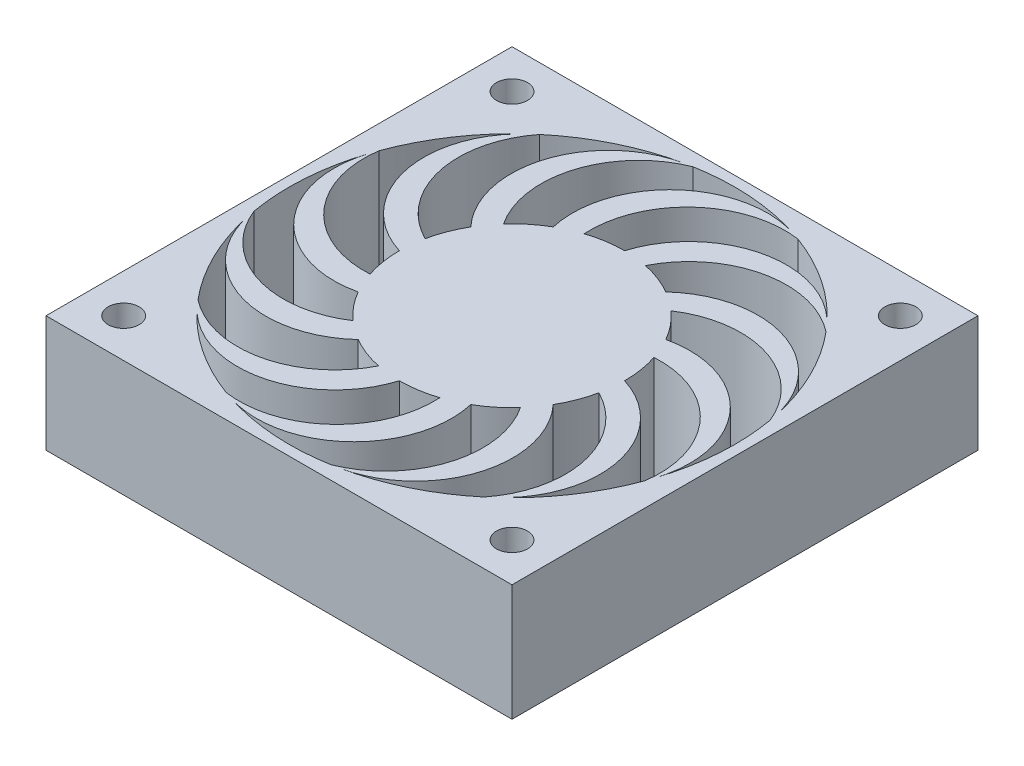
from build123d import *

# Parameters (mm, degrees)
SKETCH1_W           = 60
SKETCH1_H           = 60
BOSS_EXTRUDE1_DEPTH = 15
SKETCH2_R           = 28.7
SKETCH2_R_2         = 14.5
CUT_EXTRUDE1_DEPTH  = 87.168439698
BOSS_EXTRUDE2_DEPTH = 15
CIRPATTERN1_COUNT   = 12
SKETCH4_R           = 2
CUT_EXTRUDE2_DEPTH  = 87.168439698


with BuildPart() as part:
    # Sketch1 → Boss-Extrude1 (new body)
    with BuildSketch(Plane(origin=(0, 0, 0), x_dir=(1, 0, 0), z_dir=(0, 1, 0))):
        with Locations((30, 30)):
            Rectangle(SKETCH1_W, SKETCH1_H)
    extrude(amount=BOSS_EXTRUDE1_DEPTH)

    # Sketch2 → Cut-Extrude1 (cut, through all)
    with BuildSketch(Plane(origin=(0, 15, 0), x_dir=(1, 0, 0), z_dir=(0, 1, 0))):
        with Locations(Location((30, 30, 0), (0, 0, 270))):
            Circle(SKETCH2_R)
        with Locations(Location((30, 30, 0), (0, 0, 270))):
            Circle(SKETCH2_R_2, mode=Mode.SUBTRACT)
    extrude(amount=-CUT_EXTRUDE1_DEPTH, mode=Mode.SUBTRACT)


with BuildPart() as cut_extrude1_piece_1:
    # of the separate pieces the step leaves, piece 1, a body of its own (cut_extrude1_pieces)
    add(part.part.solids().sort_by_distance((0, 0, 0))[0])



with BuildPart() as cut_extrude1_piece_2:
    # of the separate pieces the step leaves, piece 2, a body of its own (cut_extrude1_pieces)
    add(part.part.solids().sort_by_distance((30, 0, -15.5))[0])


with BuildPart() as cut_extrude1_piece_1_1:
    add(cut_extrude1_piece_1.part)

    add(cut_extrude1_piece_2.part)  # Boss-Extrude2 merges Cut-Extrude1 piece 2
    # Sketch3 → Boss-Extrude2 (add)
    with BuildSketch(Plane(origin=(0, 15, 0), x_dir=(1, 0, 0), z_dir=(0, 1, 0))):
        with BuildLine():
            ThreePointArc((30, 44.5), (39.309158475, 53.057700875), (51.346185748, 49.184117233))
            ThreePointArc((51.346185748, 49.184117233), (51.677164158, 48.809320936), (52.001562784, 48.428815346))
            ThreePointArc((52.001562784, 48.428815346), (41.493720217, 50.817966163), (33, 44.186260959))
            ThreePointArc((33, 44.186260959), (31.508180376, 44.421351946), (30, 44.5))
        make_face()
    boss_extrude2 = extrude(amount=-BOSS_EXTRUDE2_DEPTH)

    # CirPattern1: Boss-Extrude2 ×12 about axis
    cirpattern1_axis = Axis((30, 0, -30), (0, 1, 0))
    for i in range(1, CIRPATTERN1_COUNT):
        add(boss_extrude2.rotate(cirpattern1_axis, i * 360 / CIRPATTERN1_COUNT))

    # Sketch4 → Cut-Extrude2 (cut, through all)
    with BuildSketch(Plane(origin=(0, 15, 0), x_dir=(1, 0, 0), z_dir=(0, 1, 0))):
        with Locations(Location((5, 55, 0), (0, 0, 270))):
            Circle(SKETCH4_R)
        with Locations(Location((55, 55, 0), (0, 0, 270))):
            Circle(SKETCH4_R)
        with Locations(Location((55, 5, 0), (0, 0, 270))):
            Circle(SKETCH4_R)
        with Locations(Location((5, 5, 0), (0, 0, 270))):
            Circle(SKETCH4_R)
    extrude(amount=-CUT_EXTRUDE2_DEPTH, mode=Mode.SUBTRACT)


solid = cut_extrude1_piece_1_1.part
